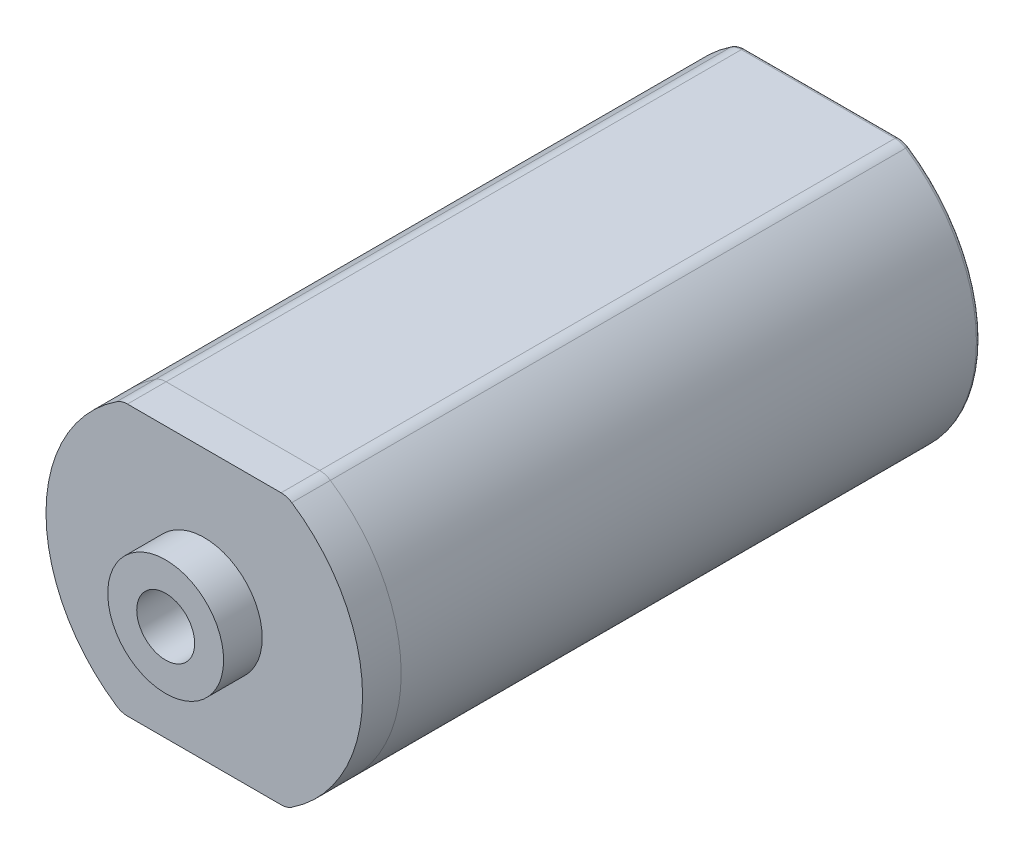
from build123d import *

# Parameters (mm, degrees)
SKETCH_1_R                    = 8.2
EXTRUDE_1_DEPTH               = 30
SKETCH_2_W                    = 19.841310119
SKETCH_2_H                    = 4.076981531
CUT_EXTRUDE_1_DEPTH           = 33.163333161
FILLET_1_R                    = 1
SHELL_1_T                     = -0.6
SKETCH_4_R                    = 3
EXTRUDE_2_DEPTH               = 2
EXTRUDE_1_2_DEPTH             = 25
EXTRUDE_3_DEPTH               = 2
EXTRUDE_START                 = 2
SKETCH_9_R                    = 3
EXTRUDE_4_DEPTH               = 2
SKETCH_6_W                    = 1.5
SKETCH_6_H                    = 36
FILLET_2_R                    = 0.2
HOLE_WIZARD_M2_5_1_AT_2_COUNT = 2
HOLE_WIZARD_M2_5_1_AT_2_PITCH = 12


with BuildPart() as part:
    # 草图1 → Extrude 1 (new body)
    with BuildSketch(Plane.XY):
        Circle(SKETCH_1_R)
    extrude(amount=EXTRUDE_1_DEPTH)

    # 草图2 → 切除-拉伸1 (cut, through all)
    with BuildSketch(Plane.XY.offset(30)):
        with Locations((0.815396306, 9.038490766)):
            Rectangle(SKETCH_2_W, SKETCH_2_H)
        with Locations((0.815396306, -9.038490766)):
            Rectangle(SKETCH_2_W, SKETCH_2_H)
    extrude(amount=-CUT_EXTRUDE_1_DEPTH, mode=Mode.SUBTRACT)

    # 圆角1
    fillet_1_edges = [part.edges().sort_by_distance(p)[0] for p in [
        (-4.270831301, 7, 15),
        (4.270831301, 7, 15),
        (4.270831301, -7, 15),
        (-4.270831301, -7, 15),
    ]]
    fillet(fillet_1_edges, radius=FILLET_1_R)

    # 抽壳1
    shell_1_openings = [part.faces().sort_by_distance(p)[0] for p in [
        (0, 0, 30),
    ]]
    offset(amount=SHELL_1_T, openings=shell_1_openings, kind=Kind.INTERSECTION)

    # 草图4 → 凸台-拉伸2 (add)
    with BuildSketch(Plane(origin=(0, 0, 0), x_dir=(-1, 0, 0), z_dir=(0, 0, -1))):
        Circle(SKETCH_4_R)
    extrude(amount=EXTRUDE_2_DEPTH)

    # 草图7 → Extrude 1 2 (add)
    with BuildSketch(Plane.XY.offset(0.6)):
        with BuildLine():
            ThreePointArc((-4.201058068, 6.333333333), (-7.6, 0), (-4.201058068, -6.333333333))
            Line((-4.201058068, -6.333333333), (-3.648287269, -5.5))
            ThreePointArc((-3.648287269, -5.5), (-6.6, 0), (-3.648287269, 5.5))
            Line((-3.648287269, 5.5), (-4.201058068, 6.333333333))
        make_face()
        with BuildLine():
            ThreePointArc((4.201058068, -6.333333333), (7.6, 0), (4.201058068, 6.333333333))
            Line((4.201058068, 6.333333333), (3.648287269, 5.5))
            ThreePointArc((3.648287269, 5.5), (6.6, 0), (3.648287269, -5.5))
            Line((3.648287269, -5.5), (4.201058068, -6.333333333))
        make_face()
    extrude(amount=EXTRUDE_1_2_DEPTH)


with BuildPart() as body_2:
    # 草图8 → 凸台-拉伸3 (new body)
    with BuildSketch(Plane.XY.offset(30)):
        with BuildLine():
            Line((-3.979949748, -7), (3.979949748, -7))
            ThreePointArc((3.979949748, -7), (4.268624883, -6.957427108), (4.532720547, -6.833333333))
            ThreePointArc((4.532720547, -6.833333333), (8.2, 0), (4.532720547, 6.833333333))
            ThreePointArc((4.532720547, 6.833333333), (4.268624883, 6.957427108), (3.979949748, 7))
            Line((3.979949748, 7), (-3.979949748, 7))
            ThreePointArc((-3.979949748, 7), (-4.268624883, 6.957427108), (-4.532720547, 6.833333333))
            ThreePointArc((-4.532720547, 6.833333333), (-8.2, 0), (-4.532720547, -6.833333333))
            ThreePointArc((-4.532720547, -6.833333333), (-4.268624883, -6.957427108), (-3.979949748, -7))
        make_face()
    extrude(amount=EXTRUDE_3_DEPTH)

    # 草图9 → 凸台-拉伸4 (add)
    with BuildSketch(Plane.XY.offset(32).offset(EXTRUDE_START)):
        Circle(SKETCH_9_R)
    extrude(amount=-EXTRUDE_4_DEPTH)


with BuildPart() as hole_wizard_3_0_3_1_tool:
    # 草图6 → Ø3.0 (3) 直径孔1 (revolve)
    with BuildSketch(Plane(origin=(0, 0, -2), x_dir=(0, 1, 0), z_dir=(1, 0, 0))):
        with Locations((0.75, 18)):
            Rectangle(SKETCH_6_W, SKETCH_6_H)
    revolve(axis=Axis((0, 0, -8.35), (0, 0, 1)))


with BuildPart() as part_1:
    add(part.part)

    # Ø3.0 (3) 直径孔1: cut by hole_wizard_3_0_3_1_tool
    add(hole_wizard_3_0_3_1_tool.part, mode=Mode.SUBTRACT)

    # 圆角2
    fillet_2_edges = [part_1.edges().sort_by_distance(p)[0] for p in [
        (-8.2, 0, 0),
        (0, -7, 0),
        (0, 7, 0),
        (8.2, 0, 0),
        (4.268624883, 6.957427108, 0),
        (-4.268624883, 6.957427108, 0),
        (4.268624883, -6.957427108, 0),
        (-4.268624883, -6.957427108, 0),
    ]]
    fillet(fillet_2_edges, radius=FILLET_2_R)

    # 草图14 → M2.5 螺纹孔1 (revolve, cut)
    with BuildSketch(Plane.YZ.offset(6)):
        Polygon((0, 0), (0, 14.615882135), (1.025, 14), (1.025, 0), align=None)
    hole_wizard_m2_5_1 = revolve(axis=Axis((6, 0, -6.35), (0, 0, 1)), mode=Mode.SUBTRACT)

    # M2.5 螺纹孔1 at 2: M2.5 螺纹孔1 ×2
    with Locations(*[(-i * HOLE_WIZARD_M2_5_1_AT_2_PITCH, 0, 0) for i in range(1, HOLE_WIZARD_M2_5_1_AT_2_COUNT)]):
        add(hole_wizard_m2_5_1, mode=Mode.SUBTRACT)


with BuildPart() as body_2_1:
    add(body_2.part)

    # Ø3.0 (3) 直径孔1: cut by hole_wizard_3_0_3_1_tool
    add(hole_wizard_3_0_3_1_tool.part, mode=Mode.SUBTRACT)


solid = Compound([part_1.part, body_2_1.part])
